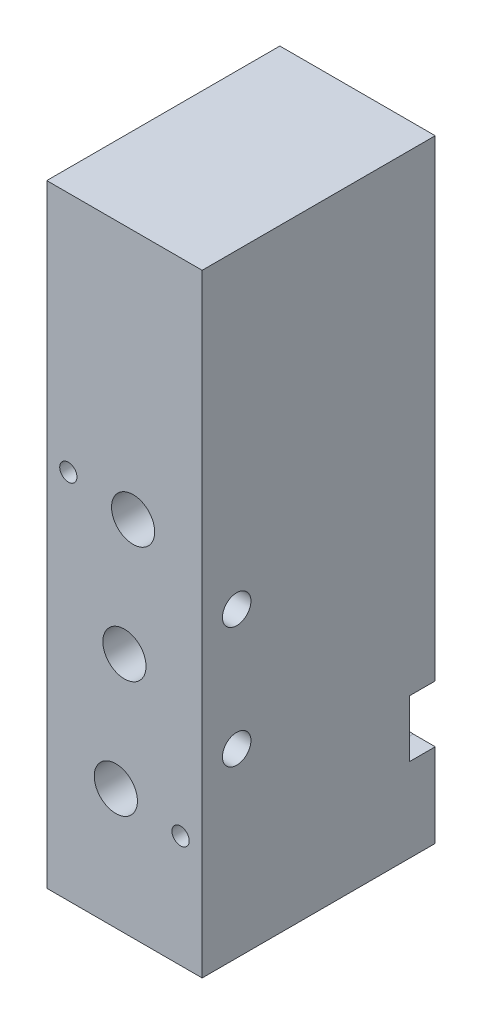
from build123d import *

# Parameters (mm, degrees)
ESQUISSE1_W             = 27
ESQUISSE1_H             = 71
BOSS_EXTRU_1_DEPTH      = 18
ESQUISSE2_R             = 1.65
ENL_V_MAT_EXTRU_1_DEPTH = 200.914193796
ESQUISSE5_R             = 2
BOSS_EXTRU_2_DEPTH      = 2.5
ESQUISSE6_R             = 2.5
ENL_V_MAT_EXTRU_2_DEPTH = 4
ENL_V_MAT_EXTRU_3_DEPTH = 3
ESQUISSE7_3_R           = 1
ENL_V_MAT_EXTRU_4_DEPTH = 138.156023146
ESQUISSE8_R             = 2.5
ENL_V_MAT_EXTRU_5_DEPTH = 4


with BuildPart() as part:
    # Esquisse1 → Boss.-Extru.1 (new body)
    with BuildSketch(Plane(origin=(0, 0, 0), x_dir=(0, 0, -1), z_dir=(1, 0, 0))):
        with Locations((134.428733504, 97.762052682)):
            Rectangle(ESQUISSE1_W, ESQUISSE1_H)
    extrude(amount=BOSS_EXTRU_1_DEPTH)

    # Esquisse2 → Enlèv. mat.-Extru.1 (cut, through all)
    with BuildSketch(Plane.ZY):
        with Locations((-124.928733504, 97.262052682)):
            Circle(ESQUISSE2_R)
        with Locations((-124.928733504, 83.262052682)):
            Circle(ESQUISSE2_R)
    extrude(amount=-ENL_V_MAT_EXTRU_1_DEPTH, mode=Mode.SUBTRACT)

    # Esquisse5 → Boss.-Extru.2 (add)
    with BuildSketch(Plane(origin=(0, 0, -147.928733504), x_dir=(-1, 0, 0), z_dir=(0, 0, -1))):
        with Locations((-9, 123.695505567)):
            Circle(ESQUISSE5_R)
    extrude(amount=BOSS_EXTRU_2_DEPTH)

    # Esquisse6 → Enlèv. mat.-Extru.2 (cut)
    with BuildSketch(Plane(origin=(0, 0, -147.928733504), x_dir=(-1, 0, 0), z_dir=(0, 0, -1))):
        with Locations((-10.5, 82.262052682)):
            Circle(ESQUISSE6_R)
        with Locations((-7.5, 98.262052682)):
            Circle(ESQUISSE6_R)
    extrude(amount=-ENL_V_MAT_EXTRU_2_DEPTH, mode=Mode.SUBTRACT)

    # Esquisse7 → Enlèv. mat.-Extru.3 (cut)
    with BuildSketch(Plane(origin=(0, 0, -147.928733504), x_dir=(-1, 0, 0), z_dir=(0, 0, -1))):
        with BuildLine():
            Line((0, 108.562052682), (-2.5, 108.562052682))
            ThreePointArc((-2.5, 108.562052682), (-5.79996536, 105.277172969), (-2.530240256, 101.962191242))
            Line((-2.530240256, 101.962191242), (0, 101.962191242))
            Line((0, 101.962191242), (0, 108.562052682))
        make_face()
        with BuildLine():
            ThreePointArc((-15.451765432, 71.962405212), (-12.200088134, 75.286170611), (-15.5, 78.562052682))
            Line((-15.5, 78.562052682), (-18, 78.562052682))
            Line((-18, 78.562052682), (-18, 71.962405212))
            Line((-18, 71.962405212), (-15.451765432, 71.962405212))
        make_face()
    extrude(amount=-ENL_V_MAT_EXTRU_3_DEPTH, mode=Mode.SUBTRACT)

    # Esquisse7<3> → Enlèv. mat.-Extru.4 (cut, through all)
    with BuildSketch(Plane(origin=(0, 0, -147.928733504), x_dir=(-1, 0, 0), z_dir=(0, 0, -1))):
        with Locations((-2.5, 105.262052682)):
            Circle(ESQUISSE7_3_R)
        with Locations((-15.5, 75.262052682)):
            Circle(ESQUISSE7_3_R)
    extrude(amount=-ENL_V_MAT_EXTRU_4_DEPTH, mode=Mode.SUBTRACT)

    # Esquisse8 → Enlèv. mat.-Extru.5 (cut)
    with BuildSketch(Plane.XY.offset(-120.928733504)):
        with Locations((8, 76.262052682)):
            Circle(ESQUISSE8_R)
        with Locations((9, 90.262052682)):
            Circle(ESQUISSE8_R)
        with Locations((10, 104.262052682)):
            Circle(ESQUISSE8_R)
    extrude(amount=-ENL_V_MAT_EXTRU_5_DEPTH, mode=Mode.SUBTRACT)


solid = part.part
